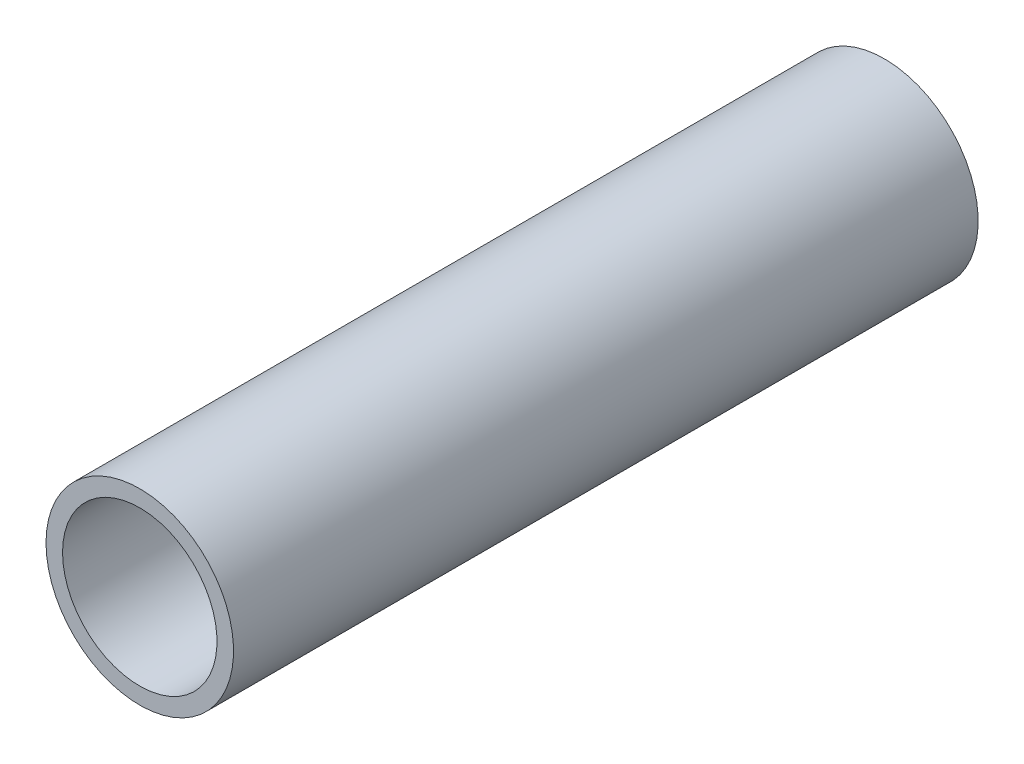
from build123d import *

# Parameters (mm, degrees)
BOSS_EXTRUDE1_DEPTH      = 40
BOSS_EXTRUDE1_DEPTH_BACK = 95
SKETCH1_R                = 17
SKETCH1_R_2              = 14


with BuildPart() as part:
    # Sketch1 → Boss-Extrude1 (new, two sides: drawn at the far end of the back side and taken through both)
    with BuildSketch(Plane.XY.offset(-BOSS_EXTRUDE1_DEPTH_BACK)):
        with Locations(Location((351.5, -25, 0), (0, 0, 180))):
            Circle(SKETCH1_R)
        with Locations(Location((351.5, -25, 0), (0, 0, 180))):
            Circle(SKETCH1_R_2, mode=Mode.SUBTRACT)
    extrude(amount=BOSS_EXTRUDE1_DEPTH + BOSS_EXTRUDE1_DEPTH_BACK)


solid = part.part
